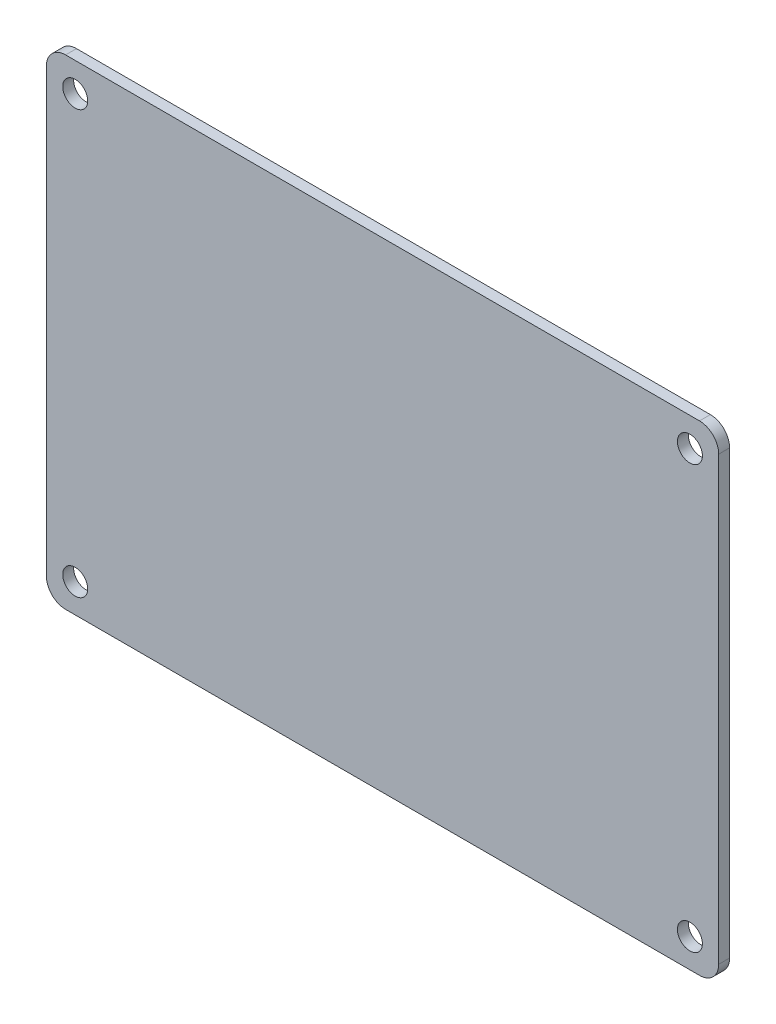
from build123d import *

# Parameters (mm, degrees)
ESQUISSE1_W                     = 105
ESQUISSE1_H                     = 75
BOSS_EXTRU_1_DEPTH              = 1.7
D_GAGEMENT_M3_51_D              = 3.9
R_P_TITION_LIN_AIRE1_COUNT      = 2
R_P_TITION_LIN_AIRE1_PITCH      = 96
R_P_TITION_LIN_AIRE1_COUNT_DIR2 = 2
R_P_TITION_LIN_AIRE1_PITCH_DIR2 = 66
CONG_1_R                        = 3


with BuildPart() as part:
    # Esquisse1 → Boss.-Extru.1 (new body)
    with BuildSketch(Plane.XY):
        Rectangle(ESQUISSE1_W, ESQUISSE1_H)
    extrude(amount=BOSS_EXTRU_1_DEPTH)

    # Dégagement M3.51 (through all)
    with Locations(Plane.XY.offset(1.7)):
        with Locations((48, 33)):
            d_gagement_m3_51 = Hole(D_GAGEMENT_M3_51_D / 2)

    # Répétition linéaire1: D_gagement M3.51 2 × 2
    with Locations(*[(-i * R_P_TITION_LIN_AIRE1_PITCH, -j * R_P_TITION_LIN_AIRE1_PITCH_DIR2, 0) for i in range(R_P_TITION_LIN_AIRE1_COUNT) for j in range(R_P_TITION_LIN_AIRE1_COUNT_DIR2) if (i, j) != (0, 0)]):
        add(d_gagement_m3_51, mode=Mode.SUBTRACT)

    # Congé1
    cong_1_edges = [part.edges().sort_by_distance(p)[0] for p in [
        (52.5, -37.5, 0.85),
        (52.5, 37.5, 0.85),
        (-52.5, 37.5, 0.85),
        (-52.5, -37.5, 0.85),
    ]]
    fillet(cong_1_edges, radius=CONG_1_R)


solid = part.part
